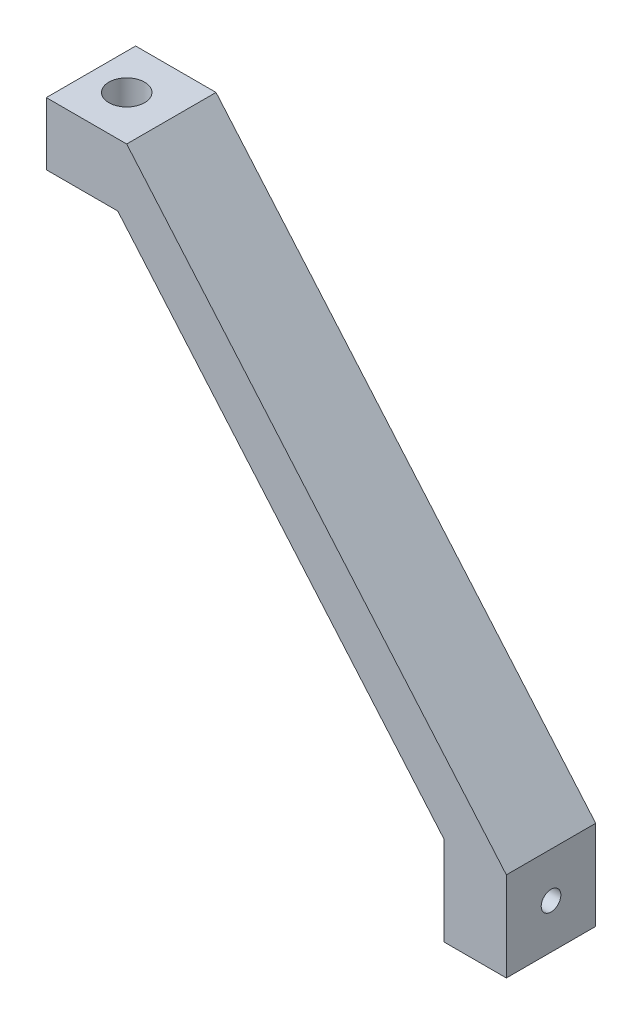
from build123d import *

# Parameters (mm, degrees)
SALIENTE_EXTRUIR1_DEPTH = 10
CROQUIS3_R              = 2
CORTAR_EXTRUIR2_DEPTH   = 10
CROQUIS4_R              = 1.1
CORTAR_EXTRUIR3_DEPTH   = 10


with BuildPart() as part:
    # Croquis1 → Saliente-Extruir1 (new body)
    with BuildSketch(Plane.XY):
        Polygon((-36.499720763, 42.6), (0, 0), (0, -10), (7, -10), (7, 0), (-35.5, 49.6), (-44.5, 49.6), (-44.5, 42.6), align=None)
    extrude(amount=SALIENTE_EXTRUIR1_DEPTH)

    # Croquis3 → Cortar-Extruir2 (cut)
    with BuildSketch(Plane(origin=(0, 49.6, 0), x_dir=(1, 0, 0), z_dir=(0, 1, 0))):
        with Locations(Location((-40.5, -5, 0), (0, 0, 270))):
            Circle(CROQUIS3_R)
    extrude(amount=-CORTAR_EXTRUIR2_DEPTH, mode=Mode.SUBTRACT)

    # Croquis4 → Cortar-Extruir3 (cut)
    with BuildSketch(Plane(origin=(7, 0, 0), x_dir=(0, 0, -1), z_dir=(1, 0, 0))):
        with Locations((-5, -5)):
            Circle(CROQUIS4_R)
    extrude(amount=-CORTAR_EXTRUIR3_DEPTH, mode=Mode.SUBTRACT)


solid = part.part
